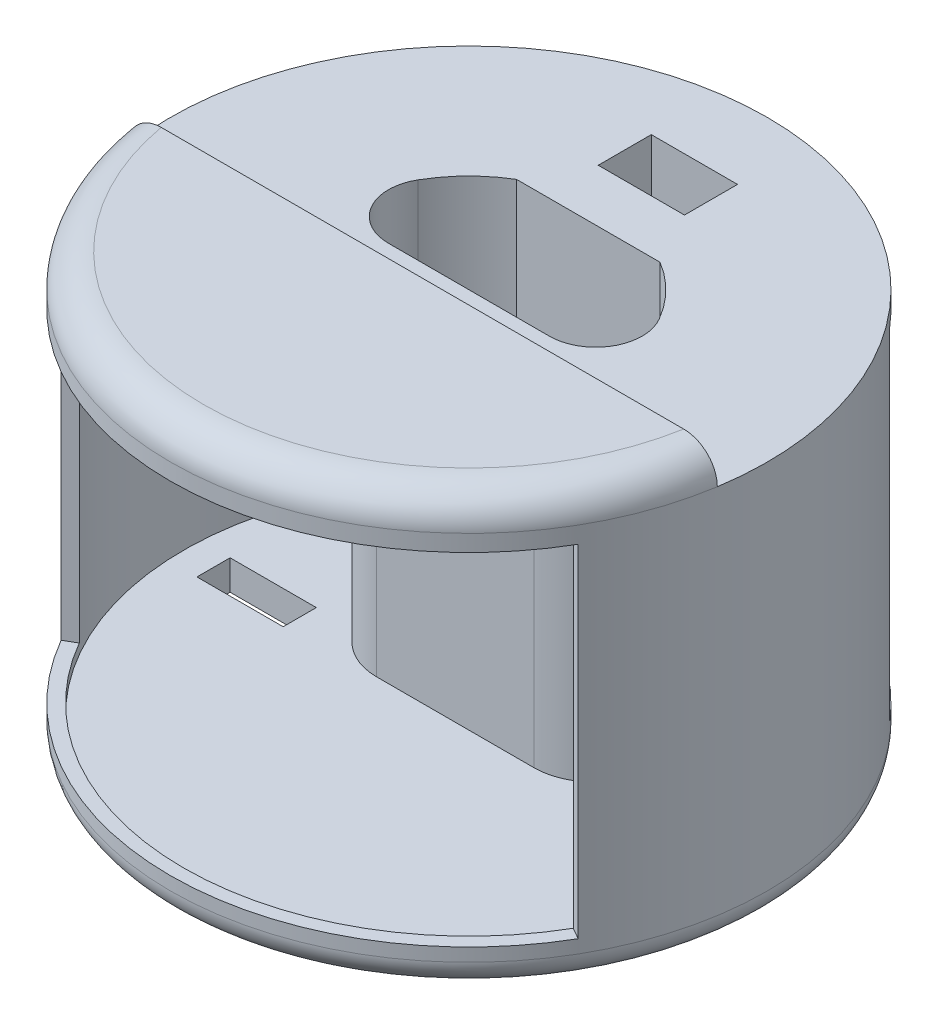
from build123d import *

# Parameters (mm, degrees)
CUT_EXTRUDE1_DEPTH           = 5
CUT_EXTRUDE3_DEPTH           = 60
SKETCH8_R                    = 43
CUT_EXTRUDE4_DEPTH           = 53
FILLET1_R                    = 7
SKETCH12_W                   = 6.5
SKETCH12_H                   = 51.5
CUT_REVOLVE1_ANGLE           = 60
CUT_REVOLVE1_OTHER_WAY_ANGLE = 60
SKETCH18_W                   = 13
SKETCH18_H                   = 8
CUT_EXTRUDE13_DEPTH          = 5
SKETCH20_W                   = 100
SKETCH20_H                   = 7
CUT_EXTRUDE15_DEPTH          = 5
SKETCH19_R                   = 1.5
CUT_EXTRUDE14_DEPTH          = 12
FILLET3_R                    = 4
SKETCH24_W                   = 2
SKETCH24_H                   = 3
BOSS_EXTRUDE3_DEPTH          = 2
CIRPATTERN2_COUNT            = 5
SKETCH26_W                   = 5
SKETCH26_H                   = 51.5
CUT_REVOLVE2_ANGLE           = 50
CUT_REVOLVE2_OTHER_WAY_ANGLE = 50
SKETCH29_W                   = 16.2
SKETCH29_H                   = 11.2
SKETCH29_W_2                 = 13
SKETCH29_H_2                 = 8
BOSS_EXTRUDE4_DEPTH          = 19
SKETCH36_W                   = 2
SKETCH36_H                   = 2
BOSS_EXTRUDE7_DEPTH          = 5
SKETCH37_W                   = 2
SKETCH37_H                   = 2
BOSS_EXTRUDE8_DEPTH          = 12.5
SKETCH40_W                   = 2
SKETCH40_H                   = 2
BOSS_EXTRUDE9_DEPTH          = 5
FILLET8_R                    = 9
SKETCH50_W                   = 13
SKETCH50_H                   = 5
CUT_EXTRUDE23_DEPTH          = 7


with BuildPart() as part:
    # Sketch1 → Revolve1 (revolve)
    with BuildSketch(Plane.XY, mode=Mode.PRIVATE) as revolve1_sk:
        with BuildLine():
            Line((0, 76.5), (0, 11.5))
            Line((0, 11.5), (22.5, 11.5))
            Line((22.5, 11.5), (22.5, 0))
            Line((22.5, 0), (25, 0))
            Line((25, 0), (25, 11.5))
            Line((25, 11.5), (45, 11.5))
            Line((45, 11.5), (45, 71.5))
            ThreePointArc((45, 71.5), (43.535533906, 75.035533906), (40, 76.5))
            Line((40, 76.5), (0, 76.5))
        make_face()
    revolve(revolve1_sk.sketch.rotate(Axis((0, 2, 0), (0, 1, 0)), 90), axis=Axis((0, 2, 0), (0, 1, 0)))

    # Sketch5 → Cut-Extrude1 (cut)
    with BuildSketch(Plane(origin=(0, 76.5, 0), x_dir=(1, 0, 0), z_dir=(0, 1, 0))):
        with BuildLine():
            Line((-45, 0), (45, 0))
            ThreePointArc((45, 0), (0, 45), (-45, 0))
        make_face()
    extrude(amount=-CUT_EXTRUDE1_DEPTH, mode=Mode.SUBTRACT)

    # Sketch7 → Cut-Extrude3 (cut)
    with BuildSketch(Plane.XZ.offset(-11.5)):
        with BuildLine():
            Line((21, 0), (-21, 0))
            ThreePointArc((-21, 0), (-18.277714988, -10.340461055), (-10.816653826, -18))
            Line((-10.816653826, -18), (10.816653826, -18))
            ThreePointArc((10.816653826, -18), (18.277714988, -10.340461055), (21, 0))
        make_face()
    extrude(amount=-CUT_EXTRUDE3_DEPTH, mode=Mode.SUBTRACT)

    # Sketch8 → Cut-Extrude4 (cut)
    with BuildSketch(Plane(origin=(0, 69, 0), x_dir=(1, 0, 0), z_dir=(0, 1, 0))):
        with Locations(Location((0, 0, 0), (0, 0, 270))):
            Circle(SKETCH8_R)
        with BuildLine():
            Line((22.912878475, -2), (-22.981606036, -2))
            ThreePointArc((-22.981606036, -2), (-20.067855169, 10.855581536), (-10.573881727, 20))
            Line((-10.573881727, 20), (10.505154166, 20))
            ThreePointArc((10.505154166, 20), (19.999127608, 10.855581536), (22.912878475, -2))
        make_face(mode=Mode.SUBTRACT)
    extrude(amount=-CUT_EXTRUDE4_DEPTH, mode=Mode.SUBTRACT)

    # Fillet1
    fillet1_edges = [part.edges().sort_by_distance(p)[0] for p in [
        (-21, 41.5, 0),
        (21, 41.5, 0),
    ]]
    fillet(fillet1_edges, radius=FILLET1_R)

    # Sketch12 → Cut-Revolve1 (revolve, cut)
    with BuildSketch(Plane(origin=(0, 0, 0), x_dir=(0, 0, -1), z_dir=(1, 0, 0))):
        with Locations((-44.75, 43.25)):
            Rectangle(SKETCH12_W, SKETCH12_H)
    revolve(axis=Axis((0, 71.5, 0), (0, -1, 0)), revolution_arc=CUT_REVOLVE1_ANGLE, mode=Mode.SUBTRACT)

    # Sketch12 → Cut-Revolve1 other way (revolve, cut)
    with BuildSketch(Plane(origin=(0, 0, 0), x_dir=(0, 0, -1), z_dir=(1, 0, 0))):
        with Locations((-44.75, 43.25)):
            Rectangle(SKETCH12_W, SKETCH12_H)
    revolve(axis=Axis((0, 71.5, 0), (0, 1, 0)), revolution_arc=CUT_REVOLVE1_OTHER_WAY_ANGLE, mode=Mode.SUBTRACT)

    # Sketch18 → Cut-Extrude13 (cut)
    with BuildSketch(Plane(origin=(0, 71.5, 0), x_dir=(1, 0, 0), z_dir=(0, 1, 0))):
        with Locations((0, 30)):
            Rectangle(SKETCH18_W, SKETCH18_H)
    extrude(amount=-CUT_EXTRUDE13_DEPTH, mode=Mode.SUBTRACT)

    # Sketch20 → Cut-Extrude15 (cut)
    with BuildSketch(Plane(origin=(0, 76.5, 0), x_dir=(1, 0, 0), z_dir=(0, 1, 0))):
        with Locations((0, -3.5)):
            Rectangle(SKETCH20_W, SKETCH20_H)
    extrude(amount=-CUT_EXTRUDE15_DEPTH, mode=Mode.SUBTRACT)

    # Sketch19 → Cut-Extrude14 (cut)
    with BuildSketch(Plane(origin=(0, 0, 7), x_dir=(-1, 0, 0), z_dir=(0, 0, -1))):
        with Locations((0, 74)):
            Circle(SKETCH19_R)
        with Locations((-30, 74)):
            Circle(SKETCH19_R)
        with Locations((29.452221542, 74)):
            Circle(SKETCH19_R)
    extrude(amount=-CUT_EXTRUDE14_DEPTH, mode=Mode.SUBTRACT)

    # Fillet3
    fillet3_edges = [part.edges().sort_by_distance(p)[0] for p in [
        (0, 11.5, 45),
    ]]
    fillet(fillet3_edges, radius=FILLET3_R)

    # Sketch24 → Boss-Extrude3 (add)
    with BuildSketch(Plane.XZ):
        with Locations((0, -22.5)):
            Rectangle(SKETCH24_W, SKETCH24_H)
    boss_extrude3 = extrude(amount=-BOSS_EXTRUDE3_DEPTH)

    # CirPattern2: Boss-Extrude3 ×5 about axis
    cirpattern2_axis = Axis((0, 0, 0), (0, 1, 0))
    for i in range(1, CIRPATTERN2_COUNT):
        add(boss_extrude3.rotate(cirpattern2_axis, i * 360 / CIRPATTERN2_COUNT))

    # Sketch26 → Cut-Revolve2 (revolve, cut)
    with BuildSketch(Plane(origin=(0, 0, 0), x_dir=(0, 0, -1), z_dir=(1, 0, 0))):
        with Locations((45.056943441, 43.25)):
            Rectangle(SKETCH26_W, SKETCH26_H)
    revolve(axis=Axis((0, 2, 0), (0, -1, 0)), revolution_arc=CUT_REVOLVE2_ANGLE, mode=Mode.SUBTRACT)

    # Sketch26 → Cut-Revolve2 other way (revolve, cut)
    with BuildSketch(Plane(origin=(0, 0, 0), x_dir=(0, 0, -1), z_dir=(1, 0, 0))):
        with Locations((45.056943441, 43.25)):
            Rectangle(SKETCH26_W, SKETCH26_H)
    revolve(axis=Axis((0, 2, 0), (0, 1, 0)), revolution_arc=CUT_REVOLVE2_OTHER_WAY_ANGLE, mode=Mode.SUBTRACT)

    # Sketch29 → Boss-Extrude4 (add)
    with BuildSketch(Plane.XZ.offset(-69)):
        with Locations((0, -30)):
            Rectangle(SKETCH29_W, SKETCH29_H)
        with Locations((0, -30)):
            Rectangle(SKETCH29_W_2, SKETCH29_H_2, mode=Mode.SUBTRACT)
    extrude(amount=BOSS_EXTRUDE4_DEPTH)

    # Fillet8
    fillet8_edges = [part.edges().sort_by_distance(p)[0] for p in [
        (-22.981606036, 42.5, 2),
        (22.912878475, 42.5, 2),
    ]]
    fillet(fillet8_edges, radius=FILLET8_R)

    # Sketch50 → Cut-Extrude23 (cut)
    with BuildSketch(Plane(origin=(0, 16, 0), x_dir=(1, 0, 0), z_dir=(0, 1, 0))):
        with Locations((32, 0)):
            Rectangle(SKETCH50_W, SKETCH50_H)
        with Locations((-32, 0)):
            Rectangle(SKETCH50_W, SKETCH50_H)
    extrude(amount=-CUT_EXTRUDE23_DEPTH, mode=Mode.SUBTRACT)


with BuildPart() as body_2:
    # Sketch36 → Boss-Extrude7 (new body)
    with BuildSketch(Plane(origin=(0, 0, -35.6), x_dir=(-1, 0, 0), z_dir=(0, 0, -1))):
        with Locations((-6.159647943, 37.918102195)):
            Rectangle(SKETCH36_W, SKETCH36_H)
    extrude(amount=BOSS_EXTRUDE7_DEPTH)

    # Sketch37 → Boss-Extrude8 (add)
    with BuildSketch(Plane.ZY.offset(-5.159647943)):
        with Locations((-39.597351245, 37.918102195)):
            Rectangle(SKETCH37_W, SKETCH37_H)
    extrude(amount=BOSS_EXTRUDE8_DEPTH)

    # Sketch40 → Boss-Extrude9 (add)
    with BuildSketch(Plane(origin=(0, 0, -35.6), x_dir=(-1, 0, 0), z_dir=(0, 0, -1))):
        with Locations((6.340352057, 37.918102195)):
            Rectangle(SKETCH40_W, SKETCH40_H)
    extrude(amount=BOSS_EXTRUDE9_DEPTH)


solid = Compound([part.part, body_2.part])
